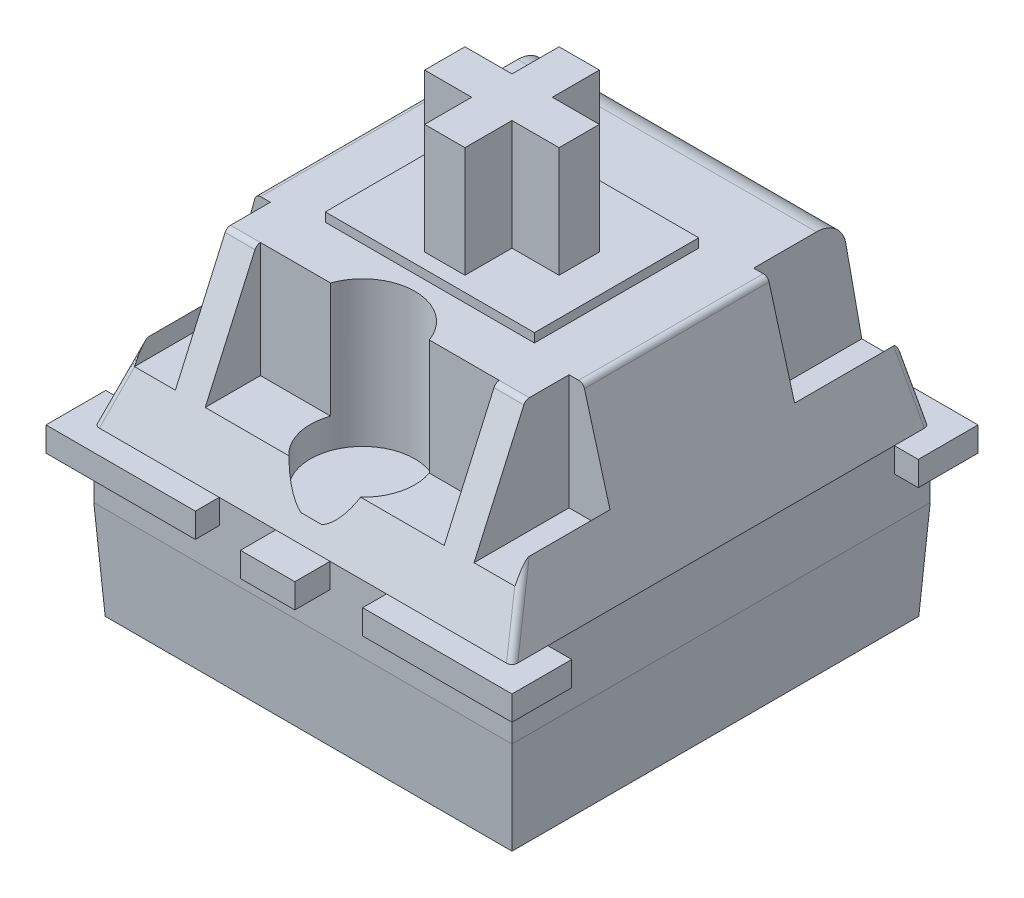
from build123d import *

# Parameters (mm, degrees)
SKETCH1_W           = 14
SKETCH1_H           = 14
BOSS_EXTRUDE1_DEPTH = 2.25
SKETCH2_W           = 14
SKETCH2_H           = 14
BOSS_EXTRUDE2_DEPTH = 3.3
BOSS_EXTRUDE2_TAPER = 3.3
SKETCH3_R           = 1.925
BOSS_EXTRUDE3_DEPTH = 3.3
CHAMFER1_SIZE       = 0.69
CHAMFER1_SIZE2      = 0.4
SKETCH4_W           = 0.86
SKETCH4_H           = 0.2
BOSS_EXTRUDE4_DEPTH = 3.3
SKETCH5_W           = 1.82
SKETCH5_H           = 1.18
BOSS_EXTRUDE5_DEPTH = 0.82
BOSS_EXTRUDE6_REACH = 21.086
CUT_EXTRUDE2_START  = -14
CUT_EXTRUDE2_DEPTH  = 14
FILLET1_R           = 1
FILLET2_R           = 0.2
SKETCH9_W           = 1.37
SKETCH9_H           = 3.91
SKETCH9_W_2         = 8
SKETCH9_H_2         = 2.578639288
CUT_EXTRUDE3_DEPTH  = 3.86
SKETCH10_R          = 1.75
CUT_EXTRUDE4_DEPTH  = 4.86
BOSS_EXTRUDE7_DEPTH = 4
SKETCH12_W          = 7
SKETCH12_H          = 5.5
BOSS_EXTRUDE8_DEPTH = 0.3


with BuildPart() as part:
    # Sketch1 → Boss-Extrude1 (new body)
    with BuildSketch(Plane(origin=(0, 0, 0), x_dir=(1, 0, 0), z_dir=(0, 1, 0))):
        Rectangle(SKETCH1_W, SKETCH1_H)
    extrude(amount=-BOSS_EXTRUDE1_DEPTH)

    # Sketch2 → Boss-Extrude2 (add)
    with BuildSketch(Plane.XZ.offset(2.25)):
        Rectangle(SKETCH2_W, SKETCH2_H)
    extrude(amount=BOSS_EXTRUDE2_DEPTH, taper=BOSS_EXTRUDE2_TAPER)

    # Sketch3 → Boss-Extrude3 (add)
    with BuildSketch(Plane.XZ.offset(5.55)):
        with Locations(Location((0, 0, 0), (0, 0, 270))):
            Circle(SKETCH3_R)
    extrude(amount=BOSS_EXTRUDE3_DEPTH)

    # Chamfer1
    chamfer1_edges = [part.edges().sort_by_distance(p)[0] for p in [
        (0, -8.85, 1.925),
    ]]
    chamfer1_side = [part.faces().sort_by_distance(p)[0] for p in [
        (0, -7.2, 1.925),
    ]]
    chamfer(chamfer1_edges, length=CHAMFER1_SIZE, length2=CHAMFER1_SIZE2, reference=chamfer1_side[0])

    # Sketch4 → Boss-Extrude4 (add)
    with BuildSketch(Plane.XZ.offset(5.55)):
        with Locations((-3.81, -2.54)):
            Rectangle(SKETCH4_W, SKETCH4_H)
        with Locations((2.54, -5.08)):
            Rectangle(SKETCH4_W, SKETCH4_H)
    extrude(amount=BOSS_EXTRUDE4_DEPTH)

    # Sketch5 → Boss-Extrude5 (add)
    with BuildSketch(Plane(origin=(0, 0, 0), x_dir=(1, 0, 0), z_dir=(0, 1, 0))):
        with Locations((0, 7.59)):
            Rectangle(SKETCH5_W, SKETCH5_H)
        Polygon((-2.8, 7), (-2.8, 7.8), (-7.8, 7.8), (-7.8, 5.8), (-7, 5.8), (-7, 7), align=None)
        Polygon((7, 7), (2.8, 7), (2.8, 7.8), (7.8, 7.8), (7.8, 5.8), (7, 5.8), align=None)
        with Locations((0, -7.59)):
            Rectangle(SKETCH5_W, SKETCH5_H)
        Polygon((2.8, -7), (2.8, -7.8), (7.8, -7.8), (7.8, -5.8), (7, -5.8), (7, -7), align=None)
        Polygon((-7, -7), (-2.8, -7), (-2.8, -7.8), (-7.8, -7.8), (-7.8, -5.8), (-7, -5.8), align=None)
    extrude(amount=-BOSS_EXTRUDE5_DEPTH)

    # Boss-Extrude6: up to this face of the body (flat: up to its plane)
    boss_extrude6_end = Plane(part.part.faces().sort_by_distance((-7, -1.172647298, 0))[0])
    # Sketch6 → Boss-Extrude6 (add, up to the picked face)
    with BuildSketch(Plane(origin=(7, 0, 0), x_dir=(0, 0, -1), z_dir=(1, 0, 0)), mode=Mode.PRIVATE) as boss_extrude6_sk1:
        Polygon((7, 0), (6.030201606, 5.5), (-4.551242231, 5.5), (-7, 0), align=None)
    boss_extrude6_tool1 = split(extrude(boss_extrude6_sk1.sketch, amount=-BOSS_EXTRUDE6_REACH, mode=Mode.PRIVATE), bisect_by=boss_extrude6_end, keep=Keep.BOTH, mode=Mode.PRIVATE)
    add(boss_extrude6_tool1.solids().sort_by(Axis((7, 2.622519, -0.3526), (-1, 0, 0)))[0])

    # Sketch8 → Cut-Extrude2 (cut)
    with BuildSketch(Plane.XY.offset(7).offset(CUT_EXTRUDE2_START)):
        Polygon((-5.474715008, 5.5), (-7, 0), (-7, 5.5), align=None)
        Polygon((7, 5.5), (5.474715008, 5.5), (7, 0), align=None)
    extrude(amount=CUT_EXTRUDE2_DEPTH, mode=Mode.SUBTRACT)

    # Fillet1
    fillet1_edges = [part.edges().sort_by_distance(p)[0] for p in [
        (0, 5.5, -6.030201606),
    ]]
    fillet(fillet1_edges, radius=FILLET1_R)

    # Fillet2
    fillet2_edges = [part.edges().sort_by_distance(p)[0] for p in [
        (0, 5.5, 4.551242231),
        (6.237357504, 2.75, 5.775621115),
        (-6.237357504, 2.75, 5.775621115),
        (6.351941325, 2.336824089, -6.587954864),
        (-6.351941325, 2.336824089, -6.587954864),
        (5.474715008, 5.5, -0.319929872),
        (5.540952526, 5.261155225, -5.839671727),
        (-5.474715008, 5.5, -0.319929872),
        (-5.540952526, 5.261155225, -5.839671727),
    ]]
    fillet(fillet2_edges, radius=FILLET2_R)

    # Sketch9 → Cut-Extrude3 (cut)
    with BuildSketch(Plane(origin=(0, 5.5, 0), x_dir=(1, 0, 0), z_dir=(0, 1, 0))):
        with Locations((-5.685, 5.045)):
            Rectangle(SKETCH9_W, SKETCH9_H)
        with Locations((5.685, 5.045)):
            Rectangle(SKETCH9_W, SKETCH9_H)
        with Locations((5.685, -5.045)):
            Rectangle(SKETCH9_W, SKETCH9_H)
        with Locations((-5.685, -5.045)):
            Rectangle(SKETCH9_W, SKETCH9_H)
        with Locations((0, -5.710680356)):
            Rectangle(SKETCH9_W_2, SKETCH9_H_2)
    extrude(amount=-CUT_EXTRUDE3_DEPTH, mode=Mode.SUBTRACT)

    # Sketch10 → Cut-Extrude4 (cut)
    with BuildSketch(Plane(origin=(0, 5.5, 0), x_dir=(1, 0, 0), z_dir=(0, 1, 0))):
        with Locations((0, -5)):
            Circle(SKETCH10_R)
    extrude(amount=-CUT_EXTRUDE4_DEPTH, mode=Mode.SUBTRACT)

    # Sketch11 → Boss-Extrude7 (add)
    with BuildSketch(Plane(origin=(0, 5.5, 0), x_dir=(1, 0, 0), z_dir=(0, 1, 0))):
        Polygon((0.675, -2.25), (-0.675, -2.25), (-0.675, -0.675), (-2.25, -0.675), (-2.25, 0.675), (-0.675, 0.675), (-0.675, 2.25), (0.675, 2.25), (0.675, 0.675), (2.25, 0.675), (2.25, -0.675), (0.675, -0.675), align=None)
    extrude(amount=BOSS_EXTRUDE7_DEPTH)

    # Sketch12 → Boss-Extrude8 (add)
    with BuildSketch(Plane(origin=(0, 5.5, 0), x_dir=(1, 0, 0), z_dir=(0, 1, 0))):
        Rectangle(SKETCH12_W, SKETCH12_H)
    extrude(amount=BOSS_EXTRUDE8_DEPTH)


solid = part.part
